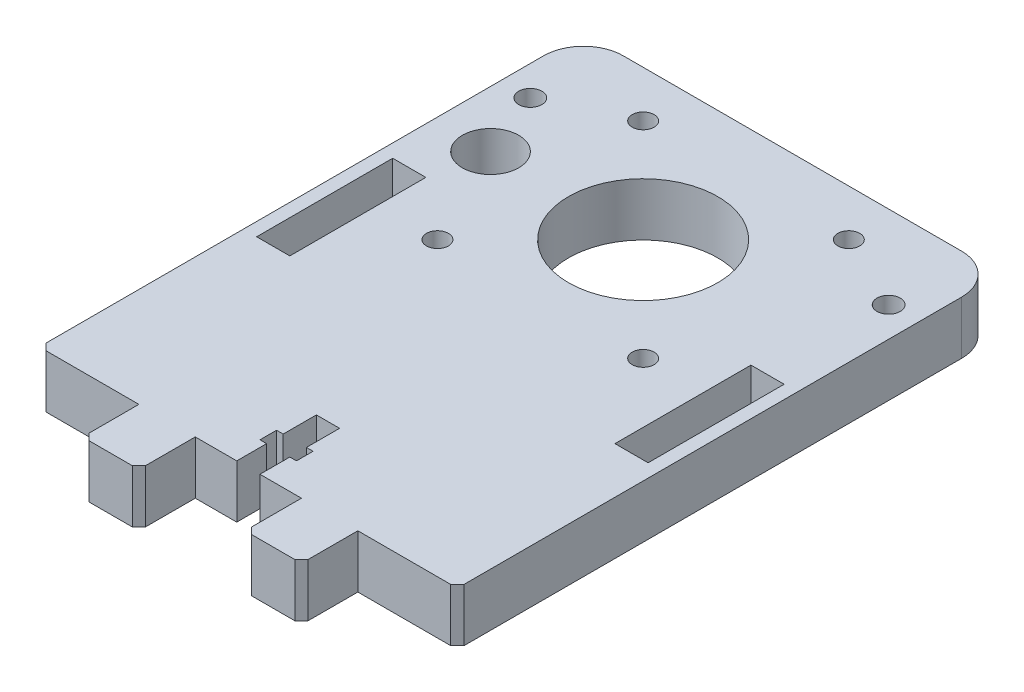
from build123d import *

# Parameters (mm, degrees)
SKETCH1_R      = 4.25
SKETCH1_R_2    = 1.65
SKETCH1_R_3    = 11.25
SKETCH1_W      = 5
SKETCH1_H      = 20.5
EXTRUDE1_DEPTH = 8
SKETCH2_R      = 1
EXTRUDE2_DEPTH = 1
SKETCH3_R      = 1.75
EXTRUDE3_DEPTH = 10


with BuildPart() as part:
    # Sketch1 → Extrude1 (new body)
    with BuildSketch(Plane(origin=(0, 0, 0), x_dir=(1, 0, 0), z_dir=(0, 1, 0))):
        with BuildLine():
            Line((4.894189333, 14.494689664), (4.894189333, 89.494689664))
            ThreePointArc((4.894189333, 89.494689664), (6.651548646, 93.737330351), (10.894189333, 95.494689664))
            Line((10.894189333, 95.494689664), (61.894189333, 95.494689664))
            ThreePointArc((61.894189333, 95.494689664), (66.136830021, 93.737330351), (67.894189333, 89.494689664))
            Line((67.894189333, 89.494689664), (67.894189333, 14.494689664))
            Line((67.894189333, 14.494689664), (66.894189333, 13.494689664))
            Line((66.894189333, 13.494689664), (52.894189333, 13.494689664))
            Line((52.894189333, 13.494689664), (52.894189333, 5.994689664))
            Line((52.894189333, 5.994689664), (51.894189333, 4.994689664))
            Line((51.894189333, 4.994689664), (45.394189333, 4.994689664))
            Line((45.394189333, 4.994689664), (44.394189333, 5.994689664))
            Line((44.394189333, 5.994689664), (44.394189333, 13.494689664))
            Line((44.394189333, 13.494689664), (38.144189333, 13.494689664))
            Line((38.144189333, 13.494689664), (38.144189333, 17.994689664))
            Line((38.144189333, 17.994689664), (39.144189333, 17.994689664))
            Line((39.144189333, 17.994689664), (39.144189333, 20.494689664))
            Line((39.144189333, 20.494689664), (38.144189333, 20.494689664))
            Line((38.144189333, 20.494689664), (38.144189333, 25.494689664))
            Line((38.144189333, 25.494689664), (34.644189333, 25.494689664))
            Line((34.644189333, 25.494689664), (34.644189333, 20.494689664))
            Line((34.644189333, 20.494689664), (33.644189333, 20.494689664))
            Line((33.644189333, 20.494689664), (33.644189333, 17.994689664))
            Line((33.644189333, 17.994689664), (34.644189333, 17.994689664))
            Line((34.644189333, 17.994689664), (34.644189333, 13.494689664))
            Line((34.644189333, 13.494689664), (28.394189333, 13.494689664))
            Line((28.394189333, 13.494689664), (28.394189333, 5.994689664))
            Line((28.394189333, 5.994689664), (27.394189333, 4.994689664))
            Line((27.394189333, 4.994689664), (20.894189333, 4.994689664))
            Line((20.894189333, 4.994689664), (19.894189333, 5.994689664))
            Line((19.894189333, 5.994689664), (19.894189333, 13.494689664))
            Line((19.894189333, 13.494689664), (5.894189333, 13.494689664))
            Line((5.894189333, 13.494689664), (4.894189333, 14.494689664))
        make_face()
        with Locations(Location((13.394189333, 72.994689664, 0), (0, 0, 270))):
            Circle(SKETCH1_R, mode=Mode.SUBTRACT)
        with Locations(Location((51.894189333, 88.494689664, 0), (0, 0, 270))):
            Circle(SKETCH1_R_2, mode=Mode.SUBTRACT)
        with Locations(Location((20.894189333, 88.494689664, 0), (0, 0, 270))):
            Circle(SKETCH1_R_2, mode=Mode.SUBTRACT)
        with Locations(Location((51.894189333, 57.494689664, 0), (0, 0, 270))):
            Circle(SKETCH1_R_2, mode=Mode.SUBTRACT)
        with Locations(Location((20.894189333, 57.494689664, 0), (0, 0, 270))):
            Circle(SKETCH1_R_2, mode=Mode.SUBTRACT)
        with Locations(Location((36.394189333, 72.994689664, 0), (0, 0, 270))):
            Circle(SKETCH1_R_3, mode=Mode.SUBTRACT)
        with Locations((9.394189333, 54.494689664)):
            Rectangle(SKETCH1_W, SKETCH1_H, mode=Mode.SUBTRACT)
        with Locations((63.394189333, 54.494689664)):
            Rectangle(SKETCH1_W, SKETCH1_H, mode=Mode.SUBTRACT)
    extrude(amount=EXTRUDE1_DEPTH)

    # Sketch2 → Extrude2 (cut)
    with BuildSketch(Plane.XY.offset(-25.494689664)):
        with Locations((36.394189333, 4)):
            Circle(SKETCH2_R)
    extrude(amount=-EXTRUDE2_DEPTH, mode=Mode.SUBTRACT)

    # Sketch3 → Extrude3 (cut)
    with BuildSketch(Plane(origin=(0, 8, 0), x_dir=(1, 0, 0), z_dir=(0, 1, 0))):
        with Locations(Location((9.394189333, 82.994689664, 0), (0, 0, 270))):
            Circle(SKETCH3_R)
        with Locations(Location((63.394189333, 82.994689664, 0), (0, 0, 270))):
            Circle(SKETCH3_R)
    extrude(amount=-EXTRUDE3_DEPTH, mode=Mode.SUBTRACT)


solid = part.part
